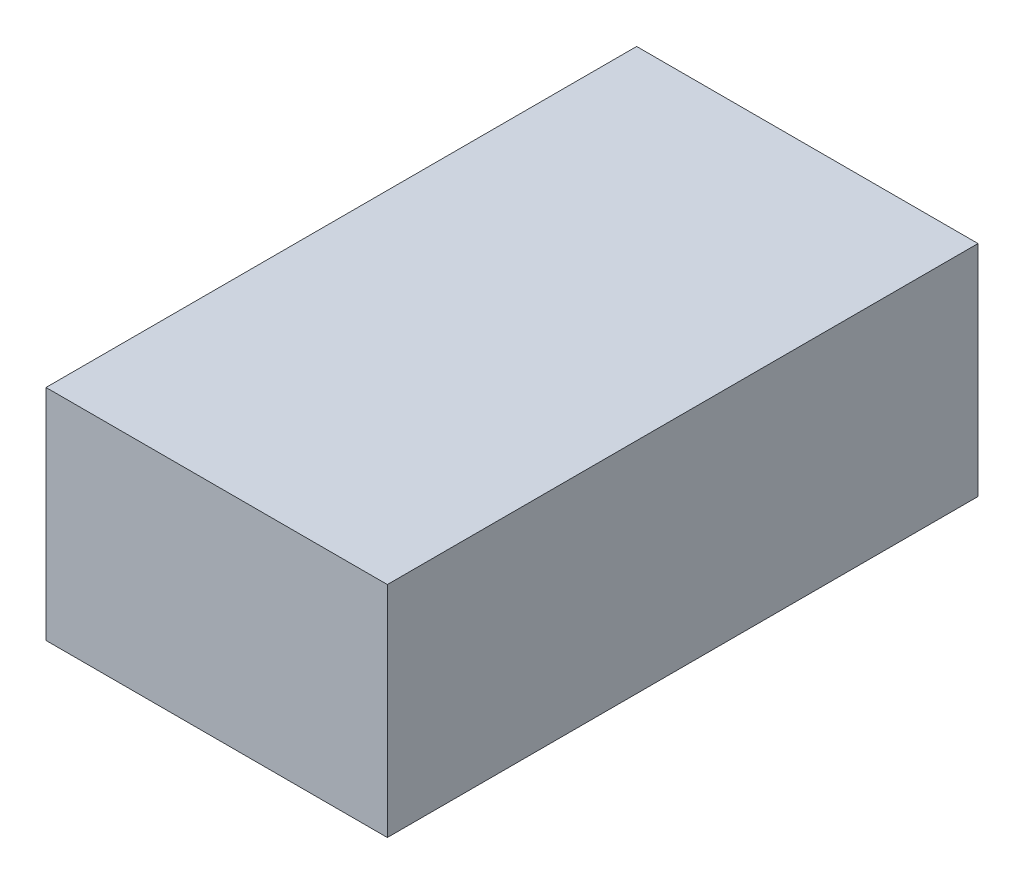
from build123d import *

# Parameters (mm, degrees)
SKETCH1_W           = 39.570621117
SKETCH1_H           = 68.469165631
BOSS_EXTRUDE1_DEPTH = 25.4


with BuildPart() as part:
    # Sketch1 → Boss-Extrude1 (new body)
    with BuildSketch(Plane(origin=(0, 0, 0), x_dir=(1, 0, 0), z_dir=(0, 1, 0))):
        with Locations((-70.087963767, -4.49666149)):
            Rectangle(SKETCH1_W, SKETCH1_H)
    extrude(amount=BOSS_EXTRUDE1_DEPTH)


solid = part.part
